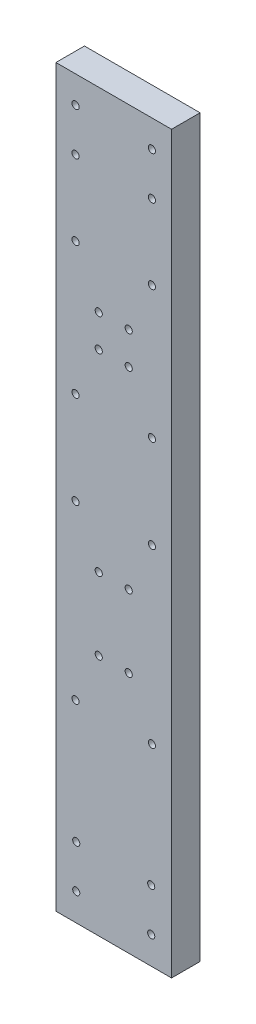
from build123d import *

# Parameters (mm, degrees)
SKETCH1_W           = 16.2
SKETCH1_H           = 102.97
SKETCH1_R           = 0.5
BOSS_EXTRUDE1_DEPTH = 4


with BuildPart() as part:
    # Sketch1 → Boss-Extrude1 (new body)
    with BuildSketch(Plane.XY):
        with Locations((8.1, 51.485)):
            Rectangle(SKETCH1_W, SKETCH1_H)
        with Locations((10.2, 71.14)):
            Circle(SKETCH1_R, mode=Mode.SUBTRACT)
        with Locations((13.45, 51.14)):
            Circle(SKETCH1_R, mode=Mode.SUBTRACT)
        with Locations((13.45, 93.17)):
            Circle(SKETCH1_R, mode=Mode.SUBTRACT)
        with Locations((6, 71.14)):
            Circle(SKETCH1_R, mode=Mode.SUBTRACT)
        with Locations(Location((2.75, 99.17, 0), (0, 0, 180))):
            Circle(SKETCH1_R, mode=Mode.SUBTRACT)
        with Locations(Location((6, 75.67, 0), (0, 0, 180))):
            Circle(SKETCH1_R, mode=Mode.SUBTRACT)
        with Locations((2.75, 51.14)):
            Circle(SKETCH1_R, mode=Mode.SUBTRACT)
        with Locations((6, 44.14)):
            Circle(SKETCH1_R, mode=Mode.SUBTRACT)
        with Locations((13.45, 27)):
            Circle(SKETCH1_R, mode=Mode.SUBTRACT)
        with Locations(Location((10.2, 75.67, 0), (0, 0, 180))):
            Circle(SKETCH1_R, mode=Mode.SUBTRACT)
        with Locations((6, 34)):
            Circle(SKETCH1_R, mode=Mode.SUBTRACT)
        with Locations((2.75, 27)):
            Circle(SKETCH1_R, mode=Mode.SUBTRACT)
        with Locations((2.75, 93.17)):
            Circle(SKETCH1_R, mode=Mode.SUBTRACT)
        with Locations((13.45, 82.67)):
            Circle(SKETCH1_R, mode=Mode.SUBTRACT)
        with Locations((13.45, 64.14)):
            Circle(SKETCH1_R, mode=Mode.SUBTRACT)
        with Locations(Location((13.45, 99.17, 0), (0, 0, 180))):
            Circle(SKETCH1_R, mode=Mode.SUBTRACT)
        with Locations((10.2, 44.14)):
            Circle(SKETCH1_R, mode=Mode.SUBTRACT)
        with Locations((2.75, 82.67)):
            Circle(SKETCH1_R, mode=Mode.SUBTRACT)
        with Locations((2.85, 9.846448831)):
            Circle(SKETCH1_R, mode=Mode.SUBTRACT)
        with Locations(Location((13.35, 9.846448831, 0), (0, 0, 180))):
            Circle(SKETCH1_R, mode=Mode.SUBTRACT)
        with Locations(Location((13.35, 3.846448831, 0), (0, 0, 180))):
            Circle(SKETCH1_R, mode=Mode.SUBTRACT)
        with Locations((2.85, 3.846448831)):
            Circle(SKETCH1_R, mode=Mode.SUBTRACT)
        with Locations((2.75, 64.14)):
            Circle(SKETCH1_R, mode=Mode.SUBTRACT)
        with Locations((10.2, 34)):
            Circle(SKETCH1_R, mode=Mode.SUBTRACT)
    extrude(amount=BOSS_EXTRUDE1_DEPTH)


solid = part.part
